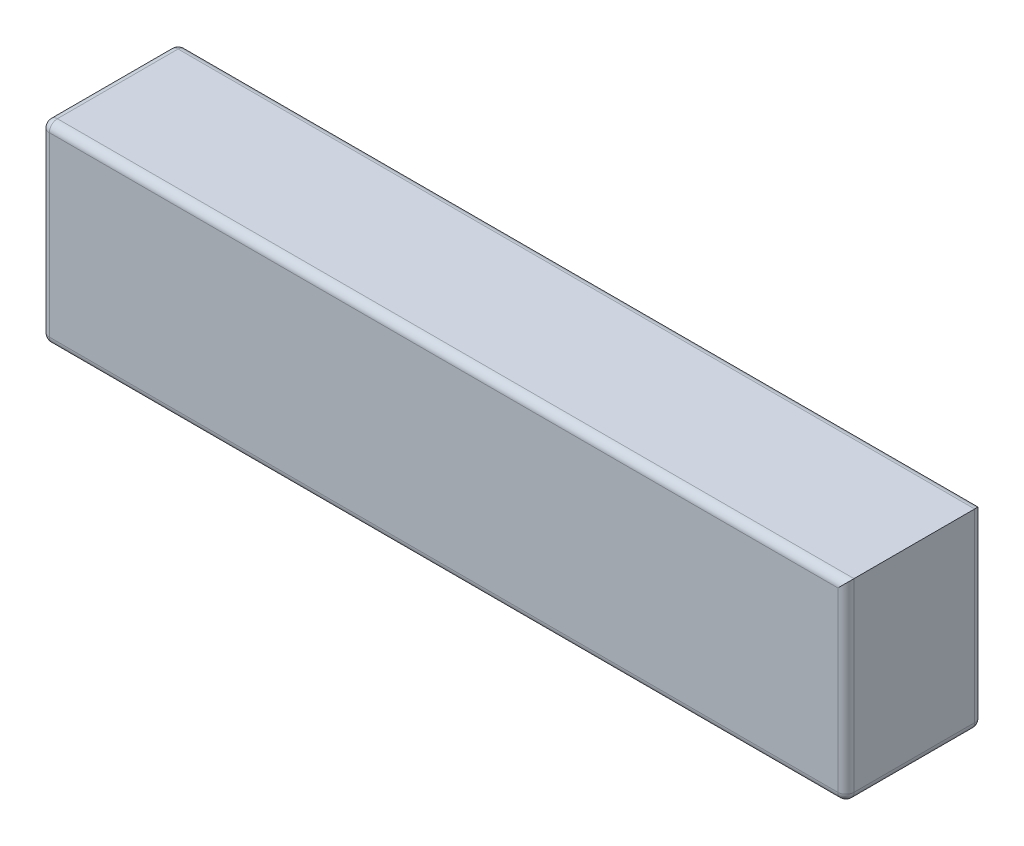
from build123d import *

# Parameters (mm, degrees)
SKETCH1_W           = 25.4
SKETCH1_H           = 6.096
BOSS_EXTRUDE1_DEPTH = 4.318
FILLET1_R           = 0.254


with BuildPart() as part:
    # Sketch1 → Boss-Extrude1 (new body)
    with BuildSketch(Plane.XY):
        Rectangle(SKETCH1_W, SKETCH1_H)
    extrude(amount=BOSS_EXTRUDE1_DEPTH)

    # Fillet1
    fillet1_edges = [part.edges().sort_by_distance(p)[0] for p in [
        (-12.7, 0, 4.318),
        (0, -3.048, 4.318),
        (12.7, 0, 4.318),
        (0, -3.048, 0),
        (-12.7, 0, 0),
        (0, 3.048, 0),
        (12.7, 0, 0),
        (12.7, -3.048, 2.159),
        (-12.7, -3.048, 2.159),
        (-12.7, 3.048, 2.159),
        (0, 3.048, 4.318),
    ]]
    fillet(fillet1_edges, radius=FILLET1_R)


solid = part.part
